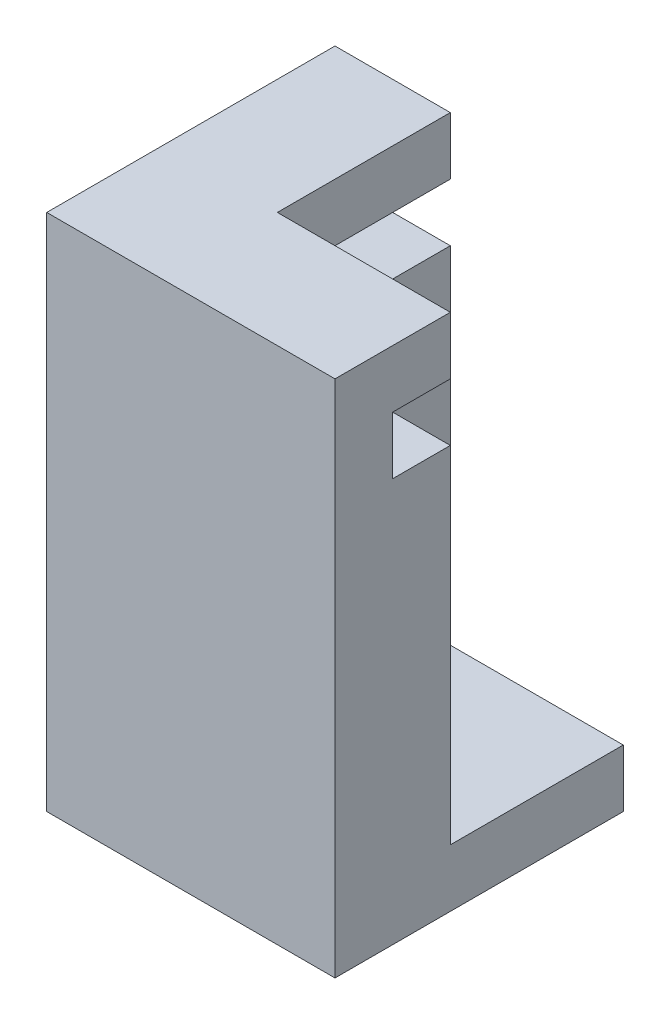
from build123d import *

# Parameters (mm, degrees)
EXTRUDE_1_DEPTH     = 40
SKETCH_2_W          = 25
SKETCH_2_H          = 25
EXTRUDE_2_DEPTH     = 5
SKETCH_3_W          = 20
SKETCH_3_H          = 5
CUT_EXTRUDE_1_DEPTH = 20


with BuildPart() as part:
    # 스케치1 → 보스-돌출1 (new body)
    with BuildSketch(Plane(origin=(0, 0, 0), x_dir=(1, 0, 0), z_dir=(0, 1, 0))):
        Polygon((0, 0), (25, 0), (25, 10), (10, 10), (10, 25), (0, 25), align=None)
    extrude(amount=EXTRUDE_1_DEPTH)

    # 스케치2 → 보스-돌출2 (add)
    with BuildSketch(Plane.XZ):
        with Locations((12.5, -12.5)):
            Rectangle(SKETCH_2_W, SKETCH_2_H)
    extrude(amount=EXTRUDE_2_DEPTH)

    # 스케치3 → 컷-돌출1 (cut)
    with BuildSketch(Plane(origin=(0, 0, -25), x_dir=(-1, 0, 0), z_dir=(0, 0, -1))):
        with Locations((-15, 32.5)):
            Rectangle(SKETCH_3_W, SKETCH_3_H)
    extrude(amount=-CUT_EXTRUDE_1_DEPTH, mode=Mode.SUBTRACT)


solid = part.part
